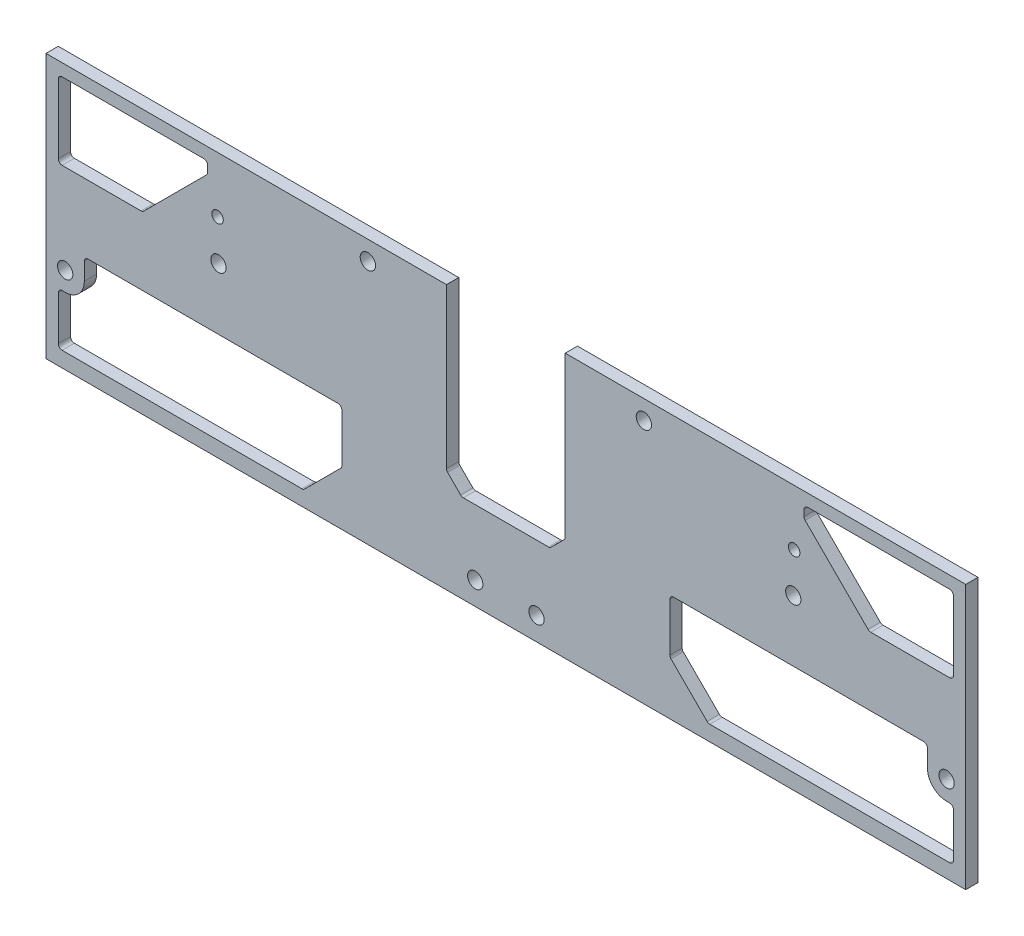
from build123d import *

# Parameters (mm, degrees)
SKETCH1_W               = 120
SKETCH1_H               = 34.5
BOSS_EXTRUDE1_DEPTH     = 0.8
CUT_EXTRUDE1_DEPTH      = 65.82908298
CUT_EXTRUDE1_DEPTH_BACK = 65.82908298
SKETCH2_R               = 1
SKETCH2_R_2             = 0.75
FILLET1_R               = 0.5


with BuildPart() as part:
    # Sketch1 → Boss-Extrude1 (new, symmetric)
    with BuildSketch(Plane.XY):
        with Locations((0, 7.25)):
            Rectangle(SKETCH1_W, SKETCH1_H)
    extrude(amount=BOSS_EXTRUDE1_DEPTH, both=True)

    # Sketch2 → Cut-Extrude1 (cut, two sides: drawn at the far end of the back side and taken through both)
    with BuildSketch(Plane.XY.offset(0.8).offset(-CUT_EXTRUDE1_DEPTH_BACK)):
        with Locations((-37.5, 12)):
            Circle(SKETCH2_R)
        with Locations((-4, -7)):
            Circle(SKETCH2_R)
        with Locations((37.5, 12)):
            Circle(SKETCH2_R)
        with Locations((-57.5, 1.25)):
            Circle(SKETCH2_R)
        with Locations(Location((57.5, 1.25, 0), (0, 0, 180))):
            Circle(SKETCH2_R)
        with Locations((4, -7)):
            Circle(SKETCH2_R)
        with Locations((-18.005, 22)):
            Circle(SKETCH2_R)
        with Locations(Location((18.005, 22, 0), (0, 0, 180))):
            Circle(SKETCH2_R)
        with Locations((37.618090351, 17.2224)):
            Circle(SKETCH2_R_2)
        with Locations(Location((-37.618090351, 17.2224, 0), (0, 0, 180))):
            Circle(SKETCH2_R_2)
        with BuildLine():
            Line((-26.4, -8), (-58.4, -8))
            Line((-58.4, -8), (-58.4, -1.25))
            Line((-58.4, -1.25), (-57.5, -1.25))
            ThreePointArc((-57.5, -1.25), (-55.732233047, -0.517766953), (-55, 1.25))
            Line((-55, 1.25), (-55, 4))
            Line((-55, 4), (-26.4, 4))
            Line((-26.4, 4), (-21.4, 4))
            Line((-21.4, 4), (-21.4, -3))
            Line((-21.4, -3), (-26.4, -8))
        make_face()
        Polygon((-58.4, 22.9), (-38.9, 22.9), (-38.9, 21.4), (-47.4, 12.9), (-58.4, 12.9), align=None)
        Polygon((7.746, 24.5), (-7.746, 24.5), (-7.746, 3.5), (-5.756, 1.51), (5.756, 1.51), (7.746, 3.5), align=None)
        Polygon((58.4, 22.9), (58.4, 12.9), (47.4, 12.9), (38.9, 21.4), (38.9, 22.9), align=None)
        with BuildLine():
            Line((21.4, 4), (21.4, -3))
            Line((21.4, -3), (26.4, -8))
            Line((26.4, -8), (58.4, -8))
            Line((58.4, -8), (58.4, -1.25))
            Line((58.4, -1.25), (57.5, -1.25))
            ThreePointArc((57.5, -1.25), (55.732233047, -0.517766953), (55, 1.25))
            Line((55, 1.25), (55, 4))
            Line((55, 4), (26.4, 4))
            Line((26.4, 4), (21.4, 4))
        make_face()
    extrude(amount=CUT_EXTRUDE1_DEPTH + CUT_EXTRUDE1_DEPTH_BACK, mode=Mode.SUBTRACT)

    # Fillet1
    fillet1_edges = [part.edges().sort_by_distance(p)[0] for p in [
        (-7.746, 3.5, 0),
        (-5.756, 1.51, 0),
        (5.756, 1.51, 0),
        (7.746, 3.5, 0),
        (-26.4, -8, 0),
        (-58.4, -8, 0),
        (-21.4, -3, 0),
        (-21.4, 4, 0),
        (-55, 4, 0),
        (-58.4, -1.25, 0),
        (21.4, -3, 0),
        (26.4, -8, 0),
        (58.4, -8, 0),
        (58.4, -1.25, 0),
        (55, 4, 0),
        (21.4, 4, 0),
        (-58.4, 22.9, 0),
        (-38.9, 22.9, 0),
        (-58.4, 12.9, 0),
        (-47.4, 12.9, 0),
        (-38.9, 21.4, 0),
        (58.4, 22.9, 0),
        (58.4, 12.9, 0),
        (38.9, 22.9, 0),
        (38.9, 21.4, 0),
        (47.4, 12.9, 0),
    ]]
    fillet(fillet1_edges, radius=FILLET1_R)


solid = part.part
